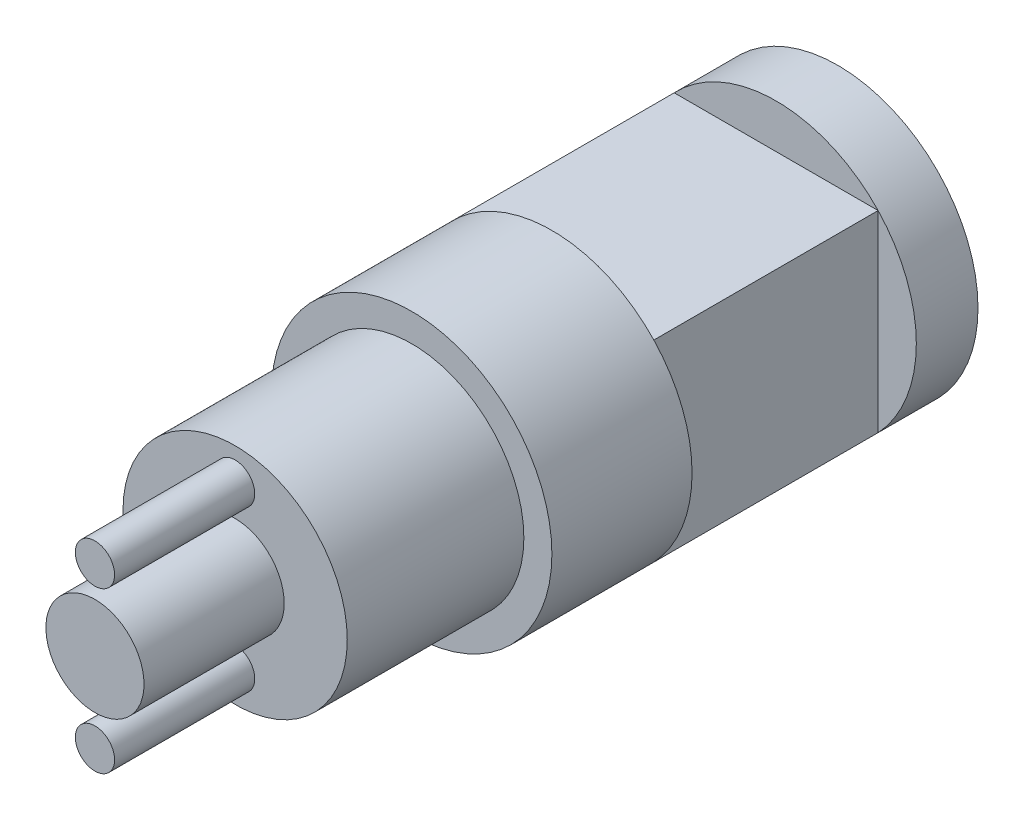
from build123d import *

# Parameters (mm, degrees)
CYLINDER_FACE_R      = 5
BASE_CYLINDER_DEPTH  = 2.2
RECTANGULAR_THING_W  = 7.274105322
RECTANGULAR_THING_H  = 6.86202534
RECTANGULAR_DEPTH    = 8
SKETCH5_R            = 5
F_2ND_CYLINDER_DEPTH = 5
SKETCH6_R            = 4
F_3RD_CYLINDER_DEPTH = 6.3
SKETCH7_R            = 1.75
TOP_CYLINDER_DEPTH   = 5
SKETCH9_R            = 0.7
PRONGS_DEPTH         = 5
CUT_EXTRUDE1_DEPTH   = 1


with BuildPart() as part:
    # Cylinder Face → Base Cylinder (new body)
    with BuildSketch(Plane.XY):
        Circle(CYLINDER_FACE_R)
    extrude(amount=BASE_CYLINDER_DEPTH)

    # rectangular thing → rectangular (add)
    with BuildSketch(Plane.XY.offset(2.2)):
        Rectangle(RECTANGULAR_THING_W, RECTANGULAR_THING_H)
    extrude(amount=RECTANGULAR_DEPTH)

    # Sketch5 → 2nd Cylinder (add)
    with BuildSketch(Plane.XY.offset(10.2)):
        with Locations(Location((0, 0, 0), (0, 0, 223.330253175))):
            Circle(SKETCH5_R)
    extrude(amount=F_2ND_CYLINDER_DEPTH)

    # Sketch6 → 3rd Cylinder (add)
    with BuildSketch(Plane.XY.offset(15.2)):
        Circle(SKETCH6_R)
    extrude(amount=F_3RD_CYLINDER_DEPTH)

    # Sketch7 → Top Cylinder (add)
    with BuildSketch(Plane.XY.offset(21.5)):
        Circle(SKETCH7_R)
    extrude(amount=TOP_CYLINDER_DEPTH)

    # Sketch9 → Prongs? (add)
    with BuildSketch(Plane.XY.offset(21.5)):
        with Locations((0, 2.857502284)):
            Circle(SKETCH9_R)
        with Locations(Location((0, -2.857502284, 0), (0, 0, 180))):
            Circle(SKETCH9_R)
    extrude(amount=PRONGS_DEPTH)

    # Sketch10 → Cut-Extrude1 (cut)
    # profile 1 of 3: a face of its own
    with BuildSketch(Plane(origin=(0, 0, 0), x_dir=(-1, 0, 0), z_dir=(0, 0, -1))):
        Polygon((-3.458075012, 1.962360203), (-3.143972448, 1.962360203), (-3.143972448, -1.178665438), (-1.797818602, -1.178665438), (-1.797818602, -1.537639797), (-3.458075012, -1.537639797), align=None)
    # profile 2 of 3: a face of its own
    with BuildSketch(Plane(origin=(0, 0, 0), x_dir=(-1, 0, 0), z_dir=(0, 0, -1))):
        Polygon((-1.214485269, 1.962360203), (0.759873706, 1.962360203), (0.759873706, 1.603385844), (-0.900382705, 1.603385844), (-0.900382705, 0.526462767), (0.759873706, 0.526462767), (0.759873706, 0.167488408), (-0.900382705, 0.167488408), (-0.900382705, -1.178665438), (0.759873706, -1.178665438), (0.759873706, -1.537639797), (-1.214485269, -1.537639797), align=None)
    # profile 3 of 3: a face of its own
    with BuildSketch(Plane(origin=(0, 0, 0), x_dir=(-1, 0, 0), z_dir=(0, 0, -1))):
        with BuildLine():
            Line((1.388078834, -1.537639797), (1.388078834, 1.962360203))
            Line((1.388078834, 1.962360203), (2.094809603, 1.962360203))
            add(Edge.make_bspline(
                [(2.094809603, 1.962360203), (2.156278591, 1.961917633), (2.275036357, 1.96106259), (2.446648804, 1.955641199), (2.605432567, 1.946050733), (2.750865426, 1.932081207), (2.883346638, 1.914928173), (3.002505246, 1.893427769), (3.108957389, 1.868039598), (3.174426829, 1.846394148), (3.205386526, 1.83615828)],
                knots=[0, 0, 0, 0, 1.314313732, 2.53924729, 3.670748893, 4.714932338, 5.66265055, 6.526160246, 7.303039223, 8, 8, 8, 8], degree=3))
            add(Edge.make_bspline(
                [(3.205386526, 1.83615828), (3.245881265, 1.820727574), (3.325952458, 1.79021608), (3.43995958, 1.732659779), (3.547284943, 1.667446677), (3.648504088, 1.594490814), (3.741304915, 1.511726466), (3.829312811, 1.42266938), (3.908927535, 1.32408104), (3.981835831, 1.218006052), (4.047571491, 1.105694), (4.104710648, 0.987358891), (4.152164642, 0.863601683), (4.191557868, 0.734766535), (4.222604326, 0.600570157), (4.243786258, 0.460856291), (4.257757247, 0.316177102), (4.259161299, 0.218002638), (4.259873706, 0.16818953)],
                knots=[0, 0, 0, 0, 0.984719456, 1.947108742, 2.898477687, 3.838006223, 4.779231079, 5.722358779, 6.681677486, 7.655904652, 8.64651281, 9.637519902, 10.640069247, 11.656948941, 12.698408672, 13.768548281, 14.867775369, 16, 16, 16, 16], degree=3))
            add(Edge.make_bspline(
                [(4.259873706, 0.16818953), (4.259244738, 0.124928291), (4.258005292, 0.039677502), (4.246875976, -0.085963393), (4.230699656, -0.207876965), (4.205655458, -0.325482665), (4.175252945, -0.439810883), (4.136288794, -0.549643127), (4.091653297, -0.655986936), (4.039603419, -0.757404412), (3.982462034, -0.853487784), (3.921140291, -0.944063313), (3.855703595, -1.027838534), (3.785527962, -1.105067146), (3.711520246, -1.175632725), (3.633195915, -1.24012474), (3.550352865, -1.297281295), (3.463362142, -1.349348403), (3.369686013, -1.394768759), (3.267550146, -1.433198769), (3.156518968, -1.465045384), (3.036865011, -1.49161628), (2.908381534, -1.512693582), (2.770942568, -1.526819975), (2.624759278, -1.536372908), (2.524380013, -1.537209301), (2.472714251, -1.537639797)],
                knots=[0, 0, 0, 0, 1.105936401, 2.179363191, 3.223086493, 4.248585256, 5.251745608, 6.245858792, 7.225916811, 8.198733463, 9.158002045, 10.082870192, 10.993790845, 11.873723703, 12.748670949, 13.606408763, 14.465103618, 15.319838547, 16.196477973, 17.123216899, 18.106603292, 19.147568657, 20.255746949, 21.433717677, 22.679120308, 24, 24, 24, 24], degree=3))
            Line((2.472714251, -1.537639797), (1.388078834, -1.537639797))
        make_face()
        with BuildLine():
            Line((1.702181398, -1.178665438), (2.103924186, -1.178665438))
            add(Edge.make_bspline(
                [(2.103924186, -1.178665438), (2.161652557, -1.178417342), (2.272685356, -1.177940162), (2.432343353, -1.173752958), (2.578222749, -1.166911021), (2.710344259, -1.157335943), (2.828633283, -1.144667328), (2.933337033, -1.130542425), (3.024112291, -1.112944974), (3.079041728, -1.096994015), (3.104424988, -1.08962297)],
                knots=[0, 0, 0, 0, 1.375205317, 2.645023457, 3.804390687, 4.853969522, 5.800190428, 6.637939096, 7.370582563, 8, 8, 8, 8], degree=3))
            add(Edge.make_bspline(
                [(3.104424988, -1.08962297), (3.13637335, -1.078371412), (3.199506988, -1.056137039), (3.290388073, -1.015579378), (3.375145078, -0.967537308), (3.455255103, -0.914135034), (3.529581759, -0.853489032), (3.599005875, -0.786918043), (3.663387676, -0.714083268), (3.722061984, -0.635075106), (3.774570288, -0.550385311), (3.820041518, -0.460846477), (3.859893049, -0.367439667), (3.891171642, -0.268730508), (3.915687226, -0.16560145), (3.933051914, -0.058045236), (3.943866638, 0.053918045), (3.945128086, 0.13007017), (3.945771142, 0.168890652)],
                knots=[0, 0, 0, 0, 0.998632004, 1.973411704, 2.929992603, 3.868527914, 4.809262121, 5.754881198, 6.702106254, 7.672490631, 8.653608572, 9.636854334, 10.631411391, 11.644891563, 12.686317036, 13.754757253, 14.855430412, 16, 16, 16, 16], degree=3))
            add(Edge.make_bspline(
                [(3.945771142, 0.168890652), (3.945257854, 0.209824132), (3.944249497, 0.290238316), (3.931575186, 0.408229012), (3.913053631, 0.521709662), (3.886269945, 0.630687857), (3.852139066, 0.73537621), (3.809544424, 0.83519572), (3.760877805, 0.931200589), (3.702974468, 1.021174954), (3.639558875, 1.106268064), (3.569180995, 1.184222979), (3.492958957, 1.255217279), (3.411724107, 1.320356592), (3.323187008, 1.377020268), (3.229433317, 1.427706949), (3.129087646, 1.47072284), (3.05927495, 1.493601703), (3.023795981, 1.505228793)],
                knots=[0, 0, 0, 0, 1.122418816, 2.205001699, 3.251619955, 4.274784885, 5.280384055, 6.268708349, 7.249350384, 8.229342522, 9.199999885, 10.157847722, 11.105861043, 12.055065948, 13.010012805, 13.98527497, 14.976112212, 16, 16, 16, 16], degree=3))
            add(Edge.make_bspline(
                [(3.023795981, 1.505228793), (2.994444835, 1.51334522), (2.932036245, 1.530602973), (2.830196781, 1.549428346), (2.715581631, 1.566032845), (2.58768193, 1.580090884), (2.446643471, 1.590178205), (2.292357783, 1.59774952), (2.124758178, 1.602856152), (2.008575645, 1.60320486), (1.948275148, 1.603385844)],
                knots=[0, 0, 0, 0, 0.674548936, 1.434276114, 2.292660221, 3.240891867, 4.284742987, 5.42552168, 6.663806718, 8, 8, 8, 8], degree=3))
            Line((1.948275148, 1.603385844), (1.702181398, 1.603385844))
            Line((1.702181398, 1.603385844), (1.702181398, -1.178665438))
        make_face(mode=Mode.SUBTRACT)
    extrude(amount=-CUT_EXTRUDE1_DEPTH, mode=Mode.SUBTRACT)


solid = part.part
